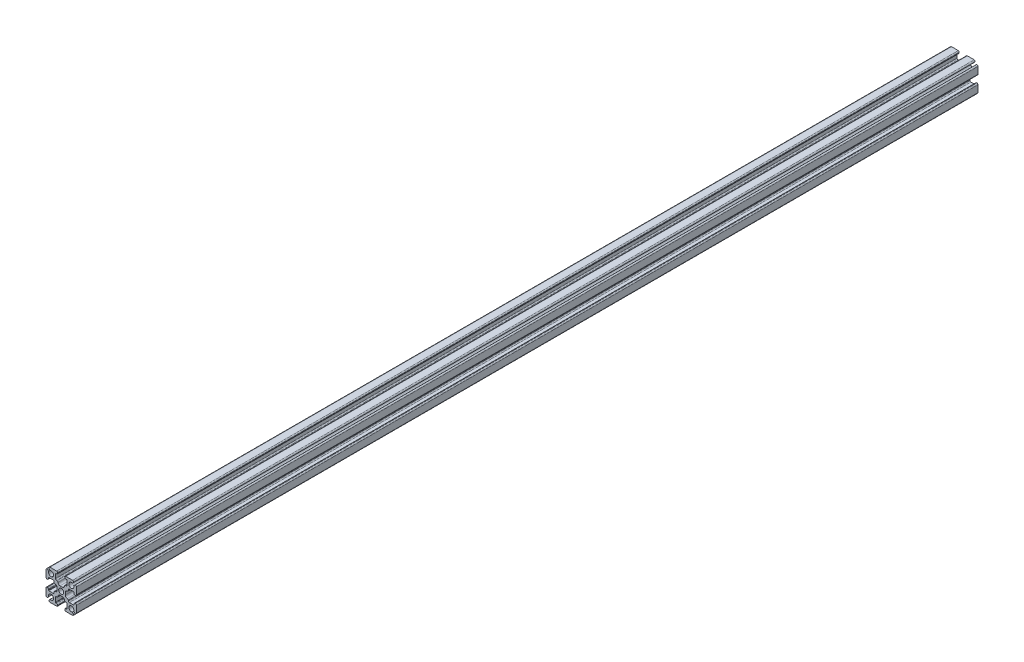
from build123d import *

# Parameters (mm, degrees)
SKETCH1_R           = 1.25
BOSS_EXTRUDE1_DEPTH = 444.5


with BuildPart() as part:
    # Sketch1 → Boss-Extrude1 (new body)
    with BuildSketch(Plane.XY):
        with BuildLine():
            Line((6.646446609, 5.939339828), (6.163645978, 5.456539197))
            ThreePointArc((6.163645978, 5.456539197), (4.116116524, 4.116116524), (5.456539197, 6.163645978))
            Line((5.456539197, 6.163645978), (5.939339828, 6.646446609))
            ThreePointArc((5.939339828, 6.646446609), (6.047726204, 7.191341716), (5.585786438, 7.5))
            Line((5.585786438, 7.5), (2.25, 7.5))
            ThreePointArc((2.25, 7.5), (1.896446609, 7.353553391), (1.75, 7))
            Line((1.75, 7), (1.75, 6.8))
            ThreePointArc((1.75, 6.8), (1.896446609, 6.446446609), (2.25, 6.3))
            Line((2.25, 6.3), (2.65, 6.3))
            ThreePointArc((2.65, 6.3), (2.791421356, 6.241421356), (2.85, 6.1))
            Line((2.85, 6.1), (2.85, 4))
            ThreePointArc((2.85, 4), (2.703553391, 3.646446609), (2.35, 3.5))
            Line((2.35, 3.5), (2.1, 3.5))
            ThreePointArc((2.1, 3.5), (1.746446609, 3.353553391), (1.6, 3))
            ThreePointArc((1.6, 3), (1.307106781, 2.292893219), (0.6, 2))
            Line((0.6, 2), (-0.6, 2))
            ThreePointArc((-0.6, 2), (-1.307106781, 2.292893219), (-1.6, 3))
            ThreePointArc((-1.6, 3), (-1.746446609, 3.353553391), (-2.1, 3.5))
            Line((-2.1, 3.5), (-2.35, 3.5))
            ThreePointArc((-2.35, 3.5), (-2.703553391, 3.646446609), (-2.85, 4))
            Line((-2.85, 4), (-2.85, 6.1))
            ThreePointArc((-2.85, 6.1), (-2.791421356, 6.241421356), (-2.65, 6.3))
            Line((-2.65, 6.3), (-2.25, 6.3))
            ThreePointArc((-2.25, 6.3), (-1.896446609, 6.446446609), (-1.75, 6.8))
            Line((-1.75, 6.8), (-1.75, 7))
            ThreePointArc((-1.75, 7), (-1.896446609, 7.353553391), (-2.25, 7.5))
            Line((-2.25, 7.5), (-5.585786438, 7.5))
            ThreePointArc((-5.585786438, 7.5), (-6.047726204, 7.191341716), (-5.939339828, 6.646446609))
            Line((-5.939339828, 6.646446609), (-5.456539197, 6.163645978))
            ThreePointArc((-5.456539197, 6.163645978), (-4.116116524, 4.116116524), (-6.163645978, 5.456539197))
            Line((-6.163645978, 5.456539197), (-6.646446609, 5.939339828))
            ThreePointArc((-6.646446609, 5.939339828), (-7.191341716, 6.047726204), (-7.5, 5.585786438))
            Line((-7.5, 5.585786438), (-7.5, 2.25))
            ThreePointArc((-7.5, 2.25), (-7.353553391, 1.896446609), (-7, 1.75))
            Line((-7, 1.75), (-6.8, 1.75))
            ThreePointArc((-6.8, 1.75), (-6.446446609, 1.896446609), (-6.3, 2.25))
            Line((-6.3, 2.25), (-6.3, 2.65))
            ThreePointArc((-6.3, 2.65), (-6.241421356, 2.791421356), (-6.1, 2.85))
            Line((-6.1, 2.85), (-4, 2.85))
            ThreePointArc((-4, 2.85), (-3.646446609, 2.703553391), (-3.5, 2.35))
            Line((-3.5, 2.35), (-3.5, 2.1))
            ThreePointArc((-3.5, 2.1), (-3.353553391, 1.746446609), (-3, 1.6))
            ThreePointArc((-3, 1.6), (-2.292893219, 1.307106781), (-2, 0.6))
            Line((-2, 0.6), (-2, -0.6))
            ThreePointArc((-2, -0.6), (-2.292893219, -1.307106781), (-3, -1.6))
            ThreePointArc((-3, -1.6), (-3.353553391, -1.746446609), (-3.5, -2.1))
            Line((-3.5, -2.1), (-3.5, -2.35))
            ThreePointArc((-3.5, -2.35), (-3.646446609, -2.703553391), (-4, -2.85))
            Line((-4, -2.85), (-6.1, -2.85))
            ThreePointArc((-6.1, -2.85), (-6.241421356, -2.791421356), (-6.3, -2.65))
            Line((-6.3, -2.65), (-6.3, -2.25))
            ThreePointArc((-6.3, -2.25), (-6.446446609, -1.896446609), (-6.8, -1.75))
            Line((-6.8, -1.75), (-7, -1.75))
            ThreePointArc((-7, -1.75), (-7.353553391, -1.896446609), (-7.5, -2.25))
            Line((-7.5, -2.25), (-7.5, -5.585786438))
            ThreePointArc((-7.5, -5.585786438), (-7.191341716, -6.047726204), (-6.646446609, -5.939339828))
            Line((-6.646446609, -5.939339828), (-6.163645978, -5.456539197))
            ThreePointArc((-6.163645978, -5.456539197), (-4.116116524, -4.116116524), (-5.456539197, -6.163645978))
            Line((-5.456539197, -6.163645978), (-5.939339828, -6.646446609))
            ThreePointArc((-5.939339828, -6.646446609), (-6.047726204, -7.191341716), (-5.585786438, -7.5))
            Line((-5.585786438, -7.5), (-2.25, -7.5))
            ThreePointArc((-2.25, -7.5), (-1.896446609, -7.353553391), (-1.75, -7))
            Line((-1.75, -7), (-1.75, -6.8))
            ThreePointArc((-1.75, -6.8), (-1.896446609, -6.446446609), (-2.25, -6.3))
            Line((-2.25, -6.3), (-2.65, -6.3))
            ThreePointArc((-2.65, -6.3), (-2.791421356, -6.241421356), (-2.85, -6.1))
            Line((-2.85, -6.1), (-2.85, -4))
            ThreePointArc((-2.85, -4), (-2.703553391, -3.646446609), (-2.35, -3.5))
            Line((-2.35, -3.5), (-2.1, -3.5))
            ThreePointArc((-2.1, -3.5), (-1.746446609, -3.353553391), (-1.6, -3))
            ThreePointArc((-1.6, -3), (-1.307106781, -2.292893219), (-0.6, -2))
            Line((-0.6, -2), (0.6, -2))
            ThreePointArc((0.6, -2), (1.307106781, -2.292893219), (1.6, -3))
            ThreePointArc((1.6, -3), (1.746446609, -3.353553391), (2.1, -3.5))
            Line((2.1, -3.5), (2.35, -3.5))
            ThreePointArc((2.35, -3.5), (2.703553391, -3.646446609), (2.85, -4))
            Line((2.85, -4), (2.85, -6.1))
            ThreePointArc((2.85, -6.1), (2.791421356, -6.241421356), (2.65, -6.3))
            Line((2.65, -6.3), (2.25, -6.3))
            ThreePointArc((2.25, -6.3), (1.896446609, -6.446446609), (1.75, -6.8))
            Line((1.75, -6.8), (1.75, -7))
            ThreePointArc((1.75, -7), (1.896446609, -7.353553391), (2.25, -7.5))
            Line((2.25, -7.5), (5.585786438, -7.5))
            ThreePointArc((5.585786438, -7.5), (6.047726204, -7.191341716), (5.939339828, -6.646446609))
            Line((5.939339828, -6.646446609), (5.456539197, -6.163645978))
            ThreePointArc((5.456539197, -6.163645978), (4.116116524, -4.116116524), (6.163645978, -5.456539197))
            Line((6.163645978, -5.456539197), (6.646446609, -5.939339828))
            ThreePointArc((6.646446609, -5.939339828), (7.191341716, -6.047726204), (7.5, -5.585786438))
            Line((7.5, -5.585786438), (7.5, -2.25))
            ThreePointArc((7.5, -2.25), (7.353553391, -1.896446609), (7, -1.75))
            Line((7, -1.75), (6.8, -1.75))
            ThreePointArc((6.8, -1.75), (6.446446609, -1.896446609), (6.3, -2.25))
            Line((6.3, -2.25), (6.3, -2.65))
            ThreePointArc((6.3, -2.65), (6.241421356, -2.791421356), (6.1, -2.85))
            Line((6.1, -2.85), (4, -2.85))
            ThreePointArc((4, -2.85), (3.646446609, -2.703553391), (3.5, -2.35))
            Line((3.5, -2.35), (3.5, -2.1))
            ThreePointArc((3.5, -2.1), (3.353553391, -1.746446609), (3, -1.6))
            ThreePointArc((3, -1.6), (2.292893219, -1.307106781), (2, -0.6))
            Line((2, -0.6), (2, 0.6))
            ThreePointArc((2, 0.6), (2.292893219, 1.307106781), (3, 1.6))
            ThreePointArc((3, 1.6), (3.353553391, 1.746446609), (3.5, 2.1))
            Line((3.5, 2.1), (3.5, 2.35))
            ThreePointArc((3.5, 2.35), (3.646446609, 2.703553391), (4, 2.85))
            Line((4, 2.85), (6.1, 2.85))
            ThreePointArc((6.1, 2.85), (6.241421356, 2.791421356), (6.3, 2.65))
            Line((6.3, 2.65), (6.3, 2.25))
            ThreePointArc((6.3, 2.25), (6.446446609, 1.896446609), (6.8, 1.75))
            Line((6.8, 1.75), (7, 1.75))
            ThreePointArc((7, 1.75), (7.353553391, 1.896446609), (7.5, 2.25))
            Line((7.5, 2.25), (7.5, 5.585786438))
            ThreePointArc((7.5, 5.585786438), (7.191341716, 6.047726204), (6.646446609, 5.939339828))
        make_face()
        with Locations(Location((0, 0, 0), (0, 0, 180))):
            Circle(SKETCH1_R, mode=Mode.SUBTRACT)
    extrude(amount=BOSS_EXTRUDE1_DEPTH)


solid = part.part
